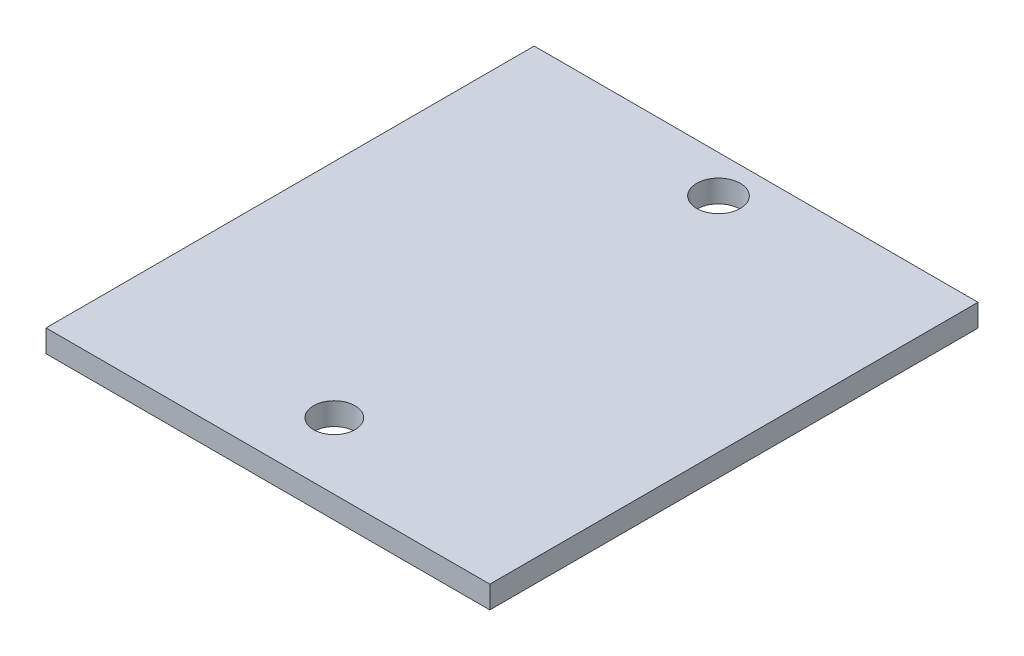
from build123d import *

# Parameters (mm, degrees)
SKETCH1_W           = 63.5
SKETCH1_H           = 69.85
SKETCH1_R           = 2.973384152
SKETCH1_R_2         = 3.120255132
BOSS_EXTRUDE1_DEPTH = 3.2004


with BuildPart() as part:
    # Sketch1 → Boss-Extrude1 (new body)
    with BuildSketch(Plane(origin=(0, 0, 0), x_dir=(1, 0, 0), z_dir=(0, 1, 0))):
        Rectangle(SKETCH1_W, SKETCH1_H)
        with Locations(Location((0, -25.427446253, 0), (0, 0, 270))):
            Circle(SKETCH1_R, mode=Mode.SUBTRACT)
        with Locations(Location((0, 29.545385535, 0), (0, 0, 270))):
            Circle(SKETCH1_R_2, mode=Mode.SUBTRACT)
    extrude(amount=BOSS_EXTRUDE1_DEPTH)


solid = part.part
